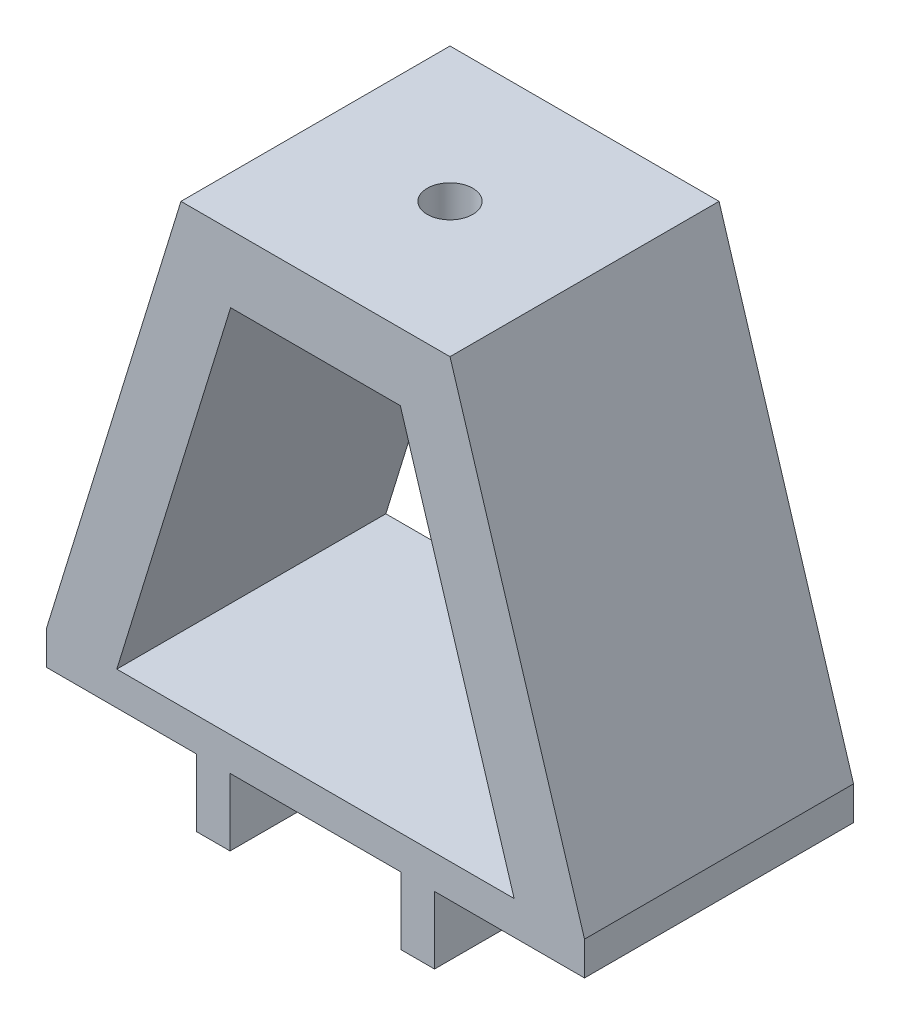
from build123d import *

# Parameters (mm, degrees)
SKETCH1_W           = 80
SKETCH1_H           = 40
BOSS_EXTRUDE1_DEPTH = 5
SKETCH2_W           = 5
SKETCH2_H           = 40
BOSS_EXTRUDE2_DEPTH = 10
SKETCH3_R           = 2.2
CUT_EXTRUDE1_DEPTH  = 62.881257259
CUT_EXTRUDE2_DEPTH  = 3
BOSS_EXTRUDE3_DEPTH = 40


with BuildPart() as part:
    # Sketch1 → Boss-Extrude1 (new body)
    with BuildSketch(Plane(origin=(0, 0, 0), x_dir=(1, 0, 0), z_dir=(0, 1, 0))):
        Rectangle(SKETCH1_W, SKETCH1_H)
    extrude(amount=BOSS_EXTRUDE1_DEPTH)

    # Sketch2 → Boss-Extrude2 (add)
    with BuildSketch(Plane.XZ):
        with Locations((15.2, 0)):
            Rectangle(SKETCH2_W, SKETCH2_H)
        with Locations((-15.2, 0)):
            Rectangle(SKETCH2_W, SKETCH2_H)
    extrude(amount=BOSS_EXTRUDE2_DEPTH)

    # Sketch3 → Cut-Extrude1 (cut, through all)
    with BuildSketch(Plane.ZY.offset(17.7)):
        with Locations((-10, -5)):
            Circle(SKETCH3_R)
        with Locations((10, -5)):
            Circle(SKETCH3_R)
    extrude(amount=-CUT_EXTRUDE1_DEPTH, mode=Mode.SUBTRACT)

    # Sketch4 → Cut-Extrude2 (cut)
    with BuildSketch(Plane.ZY.offset(17.7)):
        Polygon((-7.892671517, -1.35), (-12.107328483, -1.35), (-14.214656965, -5), (-12.107328483, -8.65), (-7.892671517, -8.65), (-5.785343035, -5), align=None)
        Polygon((12.107328483, -1.35), (7.892671517, -1.35), (5.785343035, -5), (7.892671517, -8.65), (12.107328483, -8.65), (14.214656965, -5), align=None)
    extrude(amount=-CUT_EXTRUDE2_DEPTH, mode=Mode.SUBTRACT)

    # Sketch7 → Boss-Extrude3 (add)
    with BuildSketch(Plane(origin=(0, 0, -20), x_dir=(-1, 0, 0), z_dir=(0, 0, -1))):
        Polygon((0, 70), (0, 60), (12.614253455, 60), (29.537330378, 5), (40, 5), (20, 70), align=None)
        Polygon((-12.614253455, 60), (0, 60), (0, 70), (-20, 70), (-40, 5), (-29.537330378, 5), align=None)
    extrude(amount=-BOSS_EXTRUDE3_DEPTH)

    # Sketch6 → CBORE for 1/4 Square Head Bolt1 (revolve, cut)
    with BuildSketch(Plane(origin=(0, 60, 0), x_dir=(0, 0, -1), z_dir=(1, 0, 0))):
        Polygon((0, 0), (0, 10), (3.3782, 10), (3.3782, 4.7752), (8.33374, 4.7752), (8.33374, 0.635), (8.96874, 0), align=None)
    revolve(axis=Axis((0, 53.65, 0), (0, 1, 0)), mode=Mode.SUBTRACT)


solid = part.part
